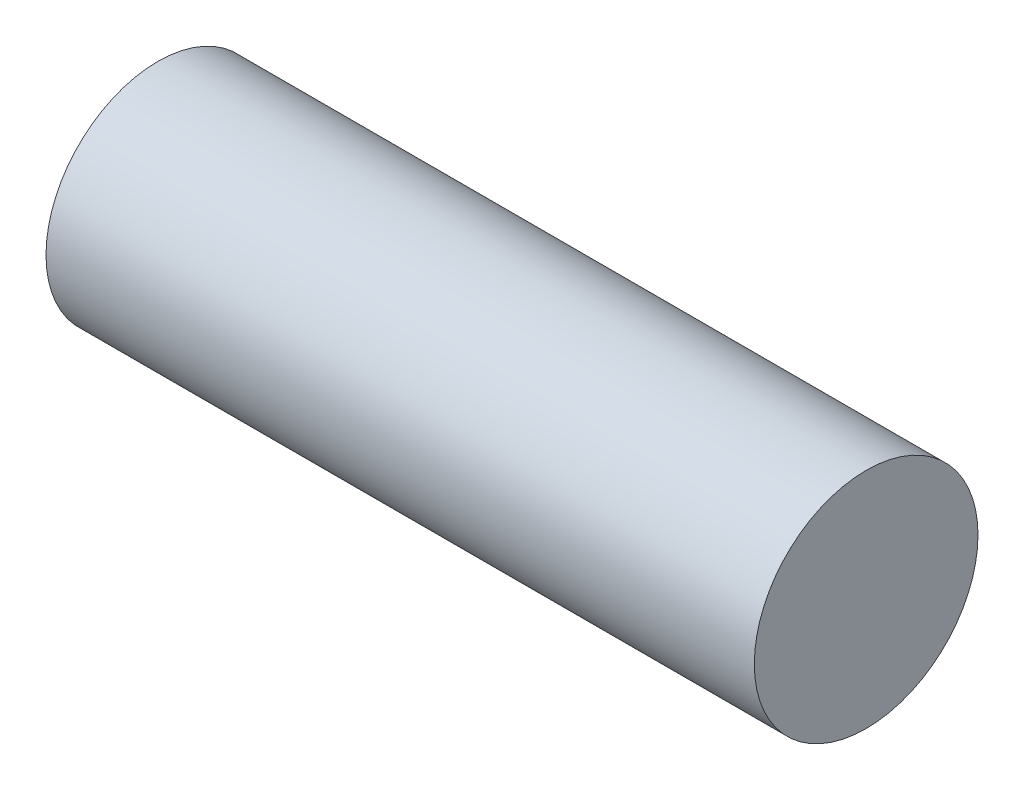
from build123d import *

# Parameters (mm, degrees)
SKETCH_1_W = 57
SKETCH_1_H = 9


with BuildPart() as part:
    # 草图1 → 旋转1 (revolve)
    with BuildSketch(Plane.XY, mode=Mode.PRIVATE) as revolve_1_sk:
        with Locations((28.5, 4.5)):
            Rectangle(SKETCH_1_W, SKETCH_1_H)
    revolve(revolve_1_sk.sketch.rotate(Axis((0, 0, 0), (1, 0, 0)), 90), axis=Axis((0, 0, 0), (1, 0, 0)))


solid = part.part
